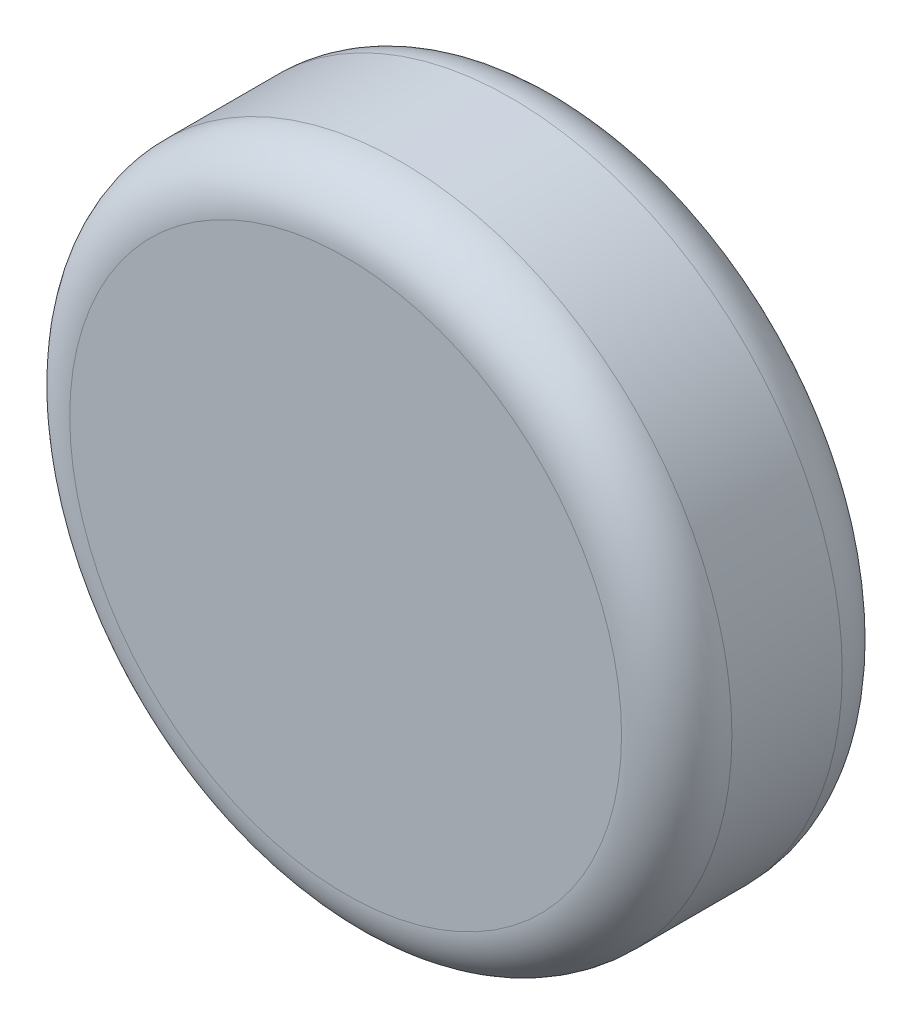
from build123d import *

# Parameters (mm, degrees)
ESBO_O1_R                = 3
RESSALTO_EXTRUS_O1_DEPTH = 2
FILETE1_R                = 0.5


with BuildPart() as part:
    # Esboço1 → Ressalto-extrusão1 (new body)
    with BuildSketch(Plane.XY):
        Circle(ESBO_O1_R)
    extrude(amount=RESSALTO_EXTRUS_O1_DEPTH)

    # Filete1
    filete1_edges = [part.edges().sort_by_distance(p)[0] for p in [
        (-3, 0, 0),
        (-3, 0, 2),
    ]]
    fillet(filete1_edges, radius=FILETE1_R)


solid = part.part
